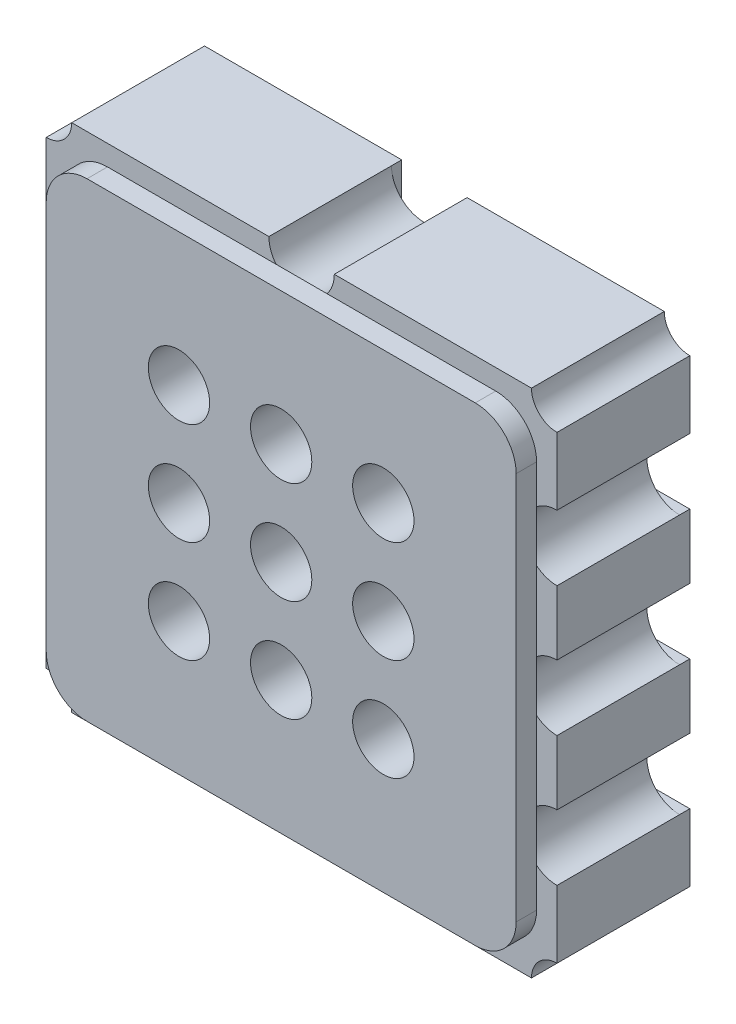
from build123d import *

# Parameters (mm, degrees)
SKETCH_1_W          = 5
SKETCH_1_H          = 5
EXTRUDE_1_DEPTH     = 1.3
SKETCH_2_W          = 4.6
SKETCH_2_H          = 4.6
EXTRUDE_2_DEPTH     = 0.2
SKETCH_3_R          = 0.3
CUT_EXTRUDE_2_DEPTH = 0.6
SKETCH_4_R          = 0.32
CUT_EXTRUDE_3_DEPTH = 1.3
SKETCH_5_R          = 0.25
CUT_EXTRUDE_4_DEPTH = 4.840572874
FILLET_1_R          = 0.4
SKETCH_8_W          = 1.17
SKETCH_8_H          = 0.64
SKETCH_8_W_2        = 0.64
SKETCH_8_H_2        = 1.23
SKETCH_8_H_3        = 2.08
CUT_EXTRUDE_5_DEPTH = 0.1


with BuildPart() as part:
    # Эскиз1 → Бобышка-Вытянуть1 (new body)
    with BuildSketch(Plane.XY):
        Rectangle(SKETCH_1_W, SKETCH_1_H)
    extrude(amount=EXTRUDE_1_DEPTH)

    # Эскиз2 → Бобышка-Вытянуть2 (add)
    with BuildSketch(Plane.XY.offset(1.3)):
        Rectangle(SKETCH_2_W, SKETCH_2_H)
    extrude(amount=EXTRUDE_2_DEPTH)

    # Эскиз3 → Вырез-Вытянуть2 (cut)
    with BuildSketch(Plane.XY.offset(1.5)):
        Circle(SKETCH_3_R)
        with Locations((1, 0)):
            Circle(SKETCH_3_R)
        with Locations((1, 1)):
            Circle(SKETCH_3_R)
        with Locations((0, 1)):
            Circle(SKETCH_3_R)
        with Locations((-1, 0)):
            Circle(SKETCH_3_R)
        with Locations((-1, 1)):
            Circle(SKETCH_3_R)
        with Locations((0, -1)):
            Circle(SKETCH_3_R)
        with Locations((1, -1)):
            Circle(SKETCH_3_R)
        with Locations((-1, -1)):
            Circle(SKETCH_3_R)
    extrude(amount=-CUT_EXTRUDE_2_DEPTH, mode=Mode.SUBTRACT)

    # Эскиз4 → Вырез-Вытянуть3 (cut)
    with BuildSketch(Plane(origin=(0, 0, 0), x_dir=(-1, 0, 0), z_dir=(0, 0, -1))):
        with Locations((-2.5, 0)):
            Circle(SKETCH_4_R)
        with Locations((2.5, 0)):
            Circle(SKETCH_4_R)
        with Locations((2.5, 1.27)):
            Circle(SKETCH_4_R)
        with Locations((-2.5, 1.27)):
            Circle(SKETCH_4_R)
        with Locations((-2.5, -1.27)):
            Circle(SKETCH_4_R)
        with Locations((2.5, -1.27)):
            Circle(SKETCH_4_R)
        with Locations((0, 2.5)):
            Circle(SKETCH_4_R)
        with Locations((0, -2.5)):
            Circle(SKETCH_4_R)
    extrude(amount=-CUT_EXTRUDE_3_DEPTH, mode=Mode.SUBTRACT)

    # Эскиз5 → Вырез-Вытянуть4 (cut, through all)
    with BuildSketch(Plane(origin=(0, 0, 0), x_dir=(-1, 0, 0), z_dir=(0, 0, -1))):
        with Locations((-2.5, 2.5)):
            Circle(SKETCH_5_R)
        with Locations((2.5, 2.5)):
            Circle(SKETCH_5_R)
        with Locations((2.5, -2.5)):
            Circle(SKETCH_5_R)
        with Locations((-2.5, -2.5)):
            Circle(SKETCH_5_R)
    extrude(amount=-CUT_EXTRUDE_4_DEPTH, mode=Mode.SUBTRACT)

    # Скругление1
    fillet_1_edges = [part.edges().sort_by_distance(p)[0] for p in [
        (-2.3, 2.3, 1.4),
        (-2.3, -2.3, 1.4),
        (2.3, -2.3, 1.4),
        (2.3, 2.3, 1.4),
    ]]
    fillet(fillet_1_edges, radius=FILLET_1_R)

    # Эскиз8 → Вырез-Вытянуть5 (cut)
    with BuildSketch(Plane(origin=(0, 0, 0), x_dir=(-1, 0, 0), z_dir=(0, 0, -1))):
        with Locations((-1.915, 1.27)):
            Rectangle(SKETCH_8_W, SKETCH_8_H)
        with Locations((-1.915, 0)):
            Rectangle(SKETCH_8_W, SKETCH_8_H)
        with Locations((-1.915, -1.27)):
            Rectangle(SKETCH_8_W, SKETCH_8_H)
        with Locations((1.915, -1.27)):
            Rectangle(SKETCH_8_W, SKETCH_8_H)
        with Locations((1.915, 0)):
            Rectangle(SKETCH_8_W, SKETCH_8_H)
        with Locations((1.915, 1.27)):
            Rectangle(SKETCH_8_W, SKETCH_8_H)
        with Locations((0, -1.885)):
            Rectangle(SKETCH_8_W_2, SKETCH_8_H_2)
        with Locations((0, 1.46)):
            Rectangle(SKETCH_8_W_2, SKETCH_8_H_3)
    extrude(amount=-CUT_EXTRUDE_5_DEPTH, mode=Mode.SUBTRACT)


solid = part.part
